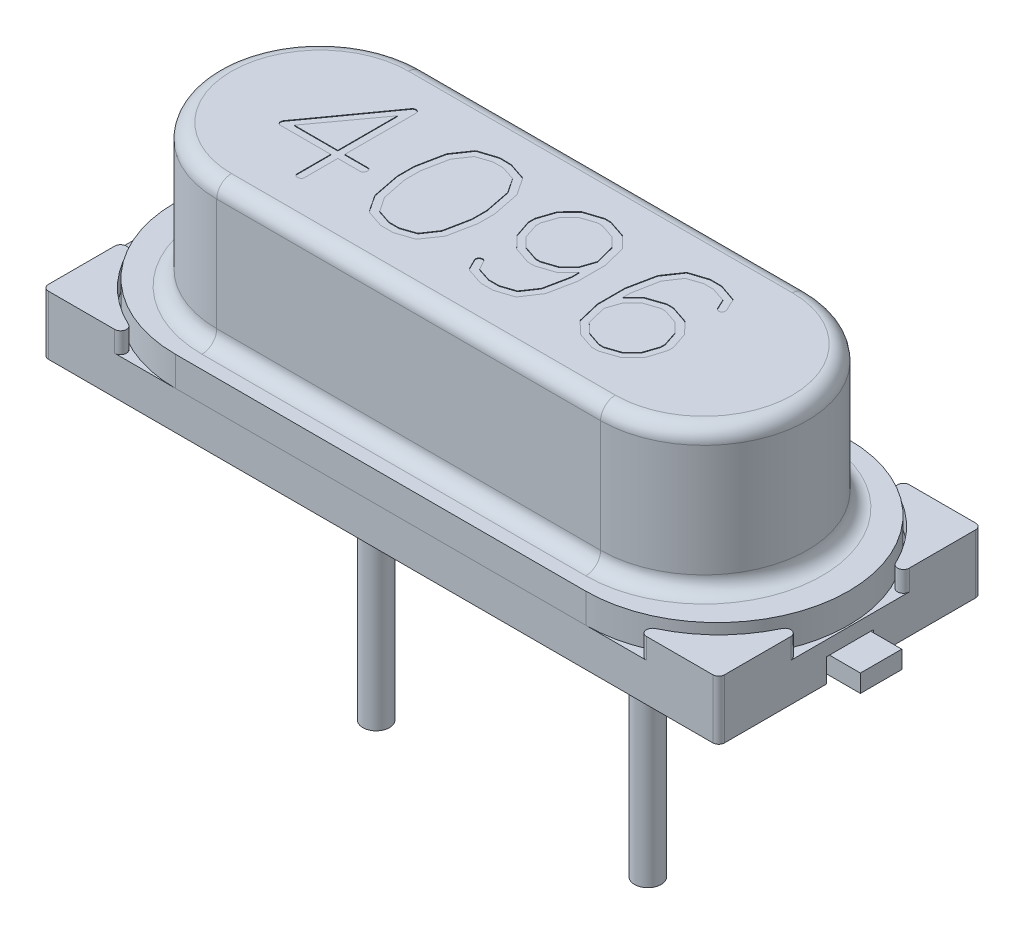
from build123d import *

# Parameters (mm, degrees)
SKETCH1_W             = 11.45
SKETCH1_H             = 4.45
BOSS_EXTRUDE1_DEPTH   = 1
CUT_EXTRUDE2_DEPTH    = 0.35
FILLET1_R             = 0.1
BOSS_EXTRUDE2_DEPTH   = 0.5
BOSS_EXTRUDE3_DEPTH   = 2.4
FILLET2_R             = 0.25
CUT_EXTRUDE3_DEPTH    = 0.01
SKETCH6_W             = 5.638304111
SKETCH6_H             = 0.8
CUT_EXTRUDE4_DEPTH    = 0.4
BOSS_EXTRUDE4_DEPTH   = 0.3
BOSS_EXTRUDE4_2_DEPTH = 0.3
SKETCH8_R             = 0.825
CUT_EXTRUDE5_DEPTH    = 0.01
SKETCH9_R             = 0.225
BOSS_EXTRUDE5_DEPTH   = 5.4


with BuildPart() as part:
    # Sketch1 → Boss-Extrude1 (new body)
    with BuildSketch(Plane(origin=(0, 0, 0), x_dir=(1, 0, 0), z_dir=(0, 1, 0))):
        Rectangle(SKETCH1_W, SKETCH1_H)
    extrude(amount=-BOSS_EXTRUDE1_DEPTH)

    # Sketch2 → Cut-Extrude2 (cut)
    with BuildSketch(Plane(origin=(0, 0, 0), x_dir=(1, 0, 0), z_dir=(0, 1, 0))):
        with BuildLine():
            Line((-3.5, 2.25), (3.5, 2.25))
            ThreePointArc((3.5, 2.25), (5.75, 0), (3.5, -2.25))
            Line((3.5, -2.25), (-3.5, -2.25))
            ThreePointArc((-3.5, -2.25), (-5.75, 0), (-3.5, 2.25))
        make_face()
    extrude(amount=-CUT_EXTRUDE2_DEPTH, mode=Mode.SUBTRACT)

    # Fillet1
    fillet1_edges = [part.edges().sort_by_distance(p)[0] for p in [
        (-3.834477204, -0.175, 2.225),
        (-5.725, -0.175, 0.334477204),
        (-5.725, -0.175, -0.334477204),
        (-3.834477204, -0.175, -2.225),
        (5.725, -0.175, -0.334477204),
        (5.725, -0.175, 0.334477204),
        (3.834477204, -0.175, 2.225),
        (3.834477204, -0.175, -2.225),
        (5.725, -0.5, 2.225),
        (-5.725, -0.5, 2.225),
        (-5.725, -0.5, -2.225),
        (5.725, -0.5, -2.225),
    ]]
    fillet(fillet1_edges, radius=FILLET1_R)

    # Sketch6 → Cut-Extrude4 (cut)
    with BuildSketch(Plane.XZ.offset(1)):
        with Locations((-5.019152056, 0)):
            Rectangle(SKETCH6_W, SKETCH6_H)
        with Locations((5.019152056, 0)):
            Rectangle(SKETCH6_W, SKETCH6_H)
    extrude(amount=-CUT_EXTRUDE4_DEPTH, mode=Mode.SUBTRACT)


with BuildPart() as body_2:
    # Sketch3 → Boss-Extrude2 (new body)
    with BuildSketch(Plane(origin=(0, -0.35, 0), x_dir=(1, 0, 0), z_dir=(0, 1, 0))):
        with BuildLine():
            Line((-3.475, 2.225), (3.475, 2.225))
            ThreePointArc((3.475, 2.225), (5.7, 0), (3.475, -2.225))
            Line((3.475, -2.225), (-3.475, -2.225))
            ThreePointArc((-3.475, -2.225), (-5.7, 0), (-3.475, 2.225))
        make_face()
    extrude(amount=BOSS_EXTRUDE2_DEPTH)

    # Sketch4 → Boss-Extrude3 (add)
    with BuildSketch(Plane(origin=(0, 0.15, 0), x_dir=(1, 0, 0), z_dir=(0, 1, 0))):
        with BuildLine():
            Line((-3.25, 1.75), (3.25, 1.75))
            ThreePointArc((3.25, 1.75), (5, 0), (3.25, -1.75))
            Line((3.25, -1.75), (-3.25, -1.75))
            ThreePointArc((-3.25, -1.75), (-5, 0), (-3.25, 1.75))
        make_face()
    extrude(amount=BOSS_EXTRUDE3_DEPTH)

    # Fillet2
    fillet2_edges = [body_2.edges().sort_by_distance(p)[0] for p in [
        (-5, 0.15, 0),
        (0, 0.15, 1.75),
        (5, 0.15, 0),
        (0, 0.15, -1.75),
        (-5, 2.55, 0),
        (0, 2.55, 1.75),
        (5, 2.55, 0),
        (0, 2.55, -1.75),
    ]]
    fillet(fillet2_edges, radius=FILLET2_R)

    # Sketch5 → Cut-Extrude3 (cut)
    # profile 1 of 4: a face of its own
    with BuildSketch(Plane(origin=(0, 2.55, 0), x_dir=(1, 0, 0), z_dir=(0, 1, 0))):
        with BuildLine():
            Line((-2.579613095, 0.972619048), (-2.571428571, 0.95327381))
            Line((-2.571428571, 0.95327381), (-2.571428571, -0.25952381))
            Line((-2.571428571, -0.25952381), (-2.175223214, -0.25952381))
            add(Edge.make_bspline(
                [(-2.175223214, -0.25952381), (-2.169995179, -0.260915744), (-2.159866911, -0.263612336), (-2.147043033, -0.273515312), (-2.139062354, -0.288483231), (-2.136940041, -0.299856703), (-2.13578869, -0.306026786)],
                knots=[0, 0, 0, 0, 0.979500305, 1.897585042, 2.859444737, 4, 4, 4, 4], degree=3))
            add(Edge.make_bspline(
                [(-2.13578869, -0.306026786), (-2.135994016, -0.313261221), (-2.136370658, -0.326531767), (-2.141042701, -0.344658389), (-2.148002784, -0.359864656), (-2.155866006, -0.366747839), (-2.159598214, -0.370014881)],
                knots=[0, 0, 0, 0, 1.223484903, 2.24430974, 3.166677144, 4, 4, 4, 4], degree=3))
            Line((-2.159598214, -0.370014881), (-2.180803571, -0.378571429))
            Line((-2.180803571, -0.378571429), (-2.571428571, -0.378571429))
            Line((-2.571428571, -0.378571429), (-2.571428571, -0.95483631))
            add(Edge.make_bspline(
                [(-2.571428571, -0.95483631), (-2.572821885, -0.959041639), (-2.575457447, -0.96699635), (-2.582647799, -0.976721347), (-2.590272887, -0.985049969), (-2.602371768, -0.991127936), (-2.615813455, -0.996051261), (-2.626454806, -0.997153279), (-2.630952381, -0.997619048)],
                knots=[0, 0, 0, 0, 1.006492665, 1.903860076, 2.74662138, 3.559717469, 4.968612883, 6, 6, 6, 6], degree=3))
            add(Edge.make_bspline(
                [(-2.630952381, -0.997619048), (-2.639748579, -0.997268595), (-2.655523951, -0.996640081), (-2.675984291, -0.987122041), (-2.689025253, -0.970173205), (-2.689969578, -0.956559469), (-2.69047619, -0.949255952)],
                knots=[0, 0, 0, 0, 1.203198397, 2.157853217, 3.011722445, 4, 4, 4, 4], degree=3))
            Line((-2.69047619, -0.949255952), (-2.69047619, -0.378571429))
            Line((-2.69047619, -0.378571429), (-3.548735119, -0.378571429))
            add(Edge.make_bspline(
                [(-3.548735119, -0.378571429), (-3.55430374, -0.377268995), (-3.564889923, -0.374793013), (-3.578838909, -0.366107964), (-3.589139275, -0.353290948), (-3.593152992, -0.342996644), (-3.595238095, -0.33764881)],
                knots=[0, 0, 0, 0, 1.042993972, 1.982775231, 2.9520629, 4, 4, 4, 4], degree=3))
            Line((-3.595238095, -0.33764881), (-3.595238095, -0.321279762))
            add(Edge.make_bspline(
                [(-3.595238095, -0.321279762), (-3.59466811, -0.314029544), (-3.59350606, -0.29924824), (-3.585534653, -0.286733442), (-3.581473214, -0.280357143)],
                knots=[0, 0, 0, 0, 0.980998486, 2, 2, 2, 2], degree=3))
            Line((-3.581473214, -0.280357143), (-3.474330357, -0.133035714))
            Line((-3.474330357, -0.133035714), (-2.670386905, 0.986011905))
            add(Edge.make_bspline(
                [(-2.670386905, 0.986011905), (-2.663572924, 0.990774378), (-2.651057582, 0.999521684), (-2.635966844, 1.001486075), (-2.629092262, 1.002380952)],
                knots=[0, 0, 0, 0, 1.088900487, 2, 2, 2, 2], degree=3))
            add(Edge.make_bspline(
                [(-2.629092262, 1.002380952), (-2.627723952, 1.002151946), (-2.623951151, 1.001520512), (-2.620274659, 1.000455526), (-2.617931548, 0.999776786)],
                knots=[0, 0, 0, 0, 0.725354991, 2, 2, 2, 2], degree=3))
            add(Edge.make_bspline(
                [(-2.617931548, 0.999776786), (-2.613257185, 0.998777727), (-2.604543442, 0.996915324), (-2.59339972, 0.99067786), (-2.584652077, 0.982739104), (-2.58128538, 0.975977587), (-2.579613095, 0.972619048)],
                knots=[0, 0, 0, 0, 1.162506102, 2.167093341, 3.089569625, 4, 4, 4, 4], degree=3))
        make_face()
        Polygon((-3.427083333, -0.25952381), (-2.69047619, -0.25952381), (-2.69047619, 0.753497024), align=None, mode=Mode.SUBTRACT)
    # profile 2 of 4: a face of its own
    with BuildSketch(Plane(origin=(0, 2.55, 0), x_dir=(1, 0, 0), z_dir=(0, 1, 0))):
        with BuildLine():
            add(Edge.make_bspline(
                [(-1.012276786, 0.999776786), (-1.003964468, 0.996935625), (-0.986337607, 0.990910741), (-0.958512879, 0.981137184), (-0.927443458, 0.970794037), (-0.89340553, 0.959193318), (-0.856114547, 0.947058565), (-0.816022517, 0.933528467), (-0.772682568, 0.919452629), (-0.742804424, 0.909632446), (-0.727306548, 0.90453869)],
                knots=[0, 0, 0, 0, 0.701660968, 1.487921959, 2.355571994, 3.317190182, 4.360247517, 5.487871983, 6.696952224, 8, 8, 8, 8], degree=3))
            Line((-0.727306548, 0.90453869), (-0.70796131, 0.885565476))
            Line((-0.70796131, 0.885565476), (-0.524553571, 0.608779762))
            Line((-0.524553571, 0.608779762), (-0.518973214, 0.592782738))
            Line((-0.518973214, 0.592782738), (-0.428571429, 0.136681548))
            Line((-0.428571429, 0.136681548), (-0.428571429, -0.145684524))
            Line((-0.428571429, -0.145684524), (-0.518973214, -0.60141369))
            Line((-0.518973214, -0.60141369), (-0.530133929, -0.620386905))
            Line((-0.530133929, -0.620386905), (-0.716145833, -0.891964286))
            Line((-0.716145833, -0.891964286), (-0.729910714, -0.902752976))
            add(Edge.make_bspline(
                [(-0.729910714, -0.902752976), (-0.739105416, -0.90529657), (-0.759452591, -0.91092535), (-0.792553647, -0.921670526), (-0.831508112, -0.934021625), (-0.873869304, -0.948928774), (-0.916129037, -0.963513835), (-0.954424903, -0.976363851), (-0.986619972, -0.987662057), (-1.00607699, -0.99451721), (-1.014880952, -0.997619048)],
                knots=[0, 0, 0, 0, 0.762114036, 1.68650047, 2.779979974, 4.027002159, 5.274024345, 6.35181635, 7.254225619, 8, 8, 8, 8], degree=3))
            Line((-1.014880952, -0.997619048), (-1.225818452, -0.997619048))
            add(Edge.make_bspline(
                [(-1.225818452, -0.997619048), (-1.234239994, -0.994856453), (-1.252165173, -0.988976294), (-1.280760187, -0.980413698), (-1.311828887, -0.969685735), (-1.346068497, -0.958691031), (-1.382985462, -0.945808849), (-1.423245207, -0.932773285), (-1.46595139, -0.917552791), (-1.495521258, -0.907547076), (-1.51078869, -0.902380952)],
                knots=[0, 0, 0, 0, 0.707906692, 1.506773219, 2.383791417, 3.332855564, 4.379031741, 5.506626567, 6.71262828, 8, 8, 8, 8], degree=3))
            Line((-1.51078869, -0.902380952), (-1.530133929, -0.886383929))
            Line((-1.530133929, -0.886383929), (-1.713541667, -0.608854167))
            Line((-1.713541667, -0.608854167), (-1.719122024, -0.592857143))
            Line((-1.719122024, -0.592857143), (-1.80952381, -0.136383929))
            Line((-1.80952381, -0.136383929), (-1.80952381, 0.151934524))
            Line((-1.80952381, 0.151934524), (-1.719122024, 0.605803571))
            Line((-1.719122024, 0.605803571), (-1.7109375, 0.621800595))
            Line((-1.7109375, 0.621800595), (-1.524553571, 0.89375))
            Line((-1.524553571, 0.89375), (-1.508184524, 0.907142857))
            add(Edge.make_bspline(
                [(-1.508184524, 0.907142857), (-1.498875926, 0.909844311), (-1.478228109, 0.915836527), (-1.444290808, 0.926394155), (-1.404215322, 0.938977638), (-1.360062712, 0.953225751), (-1.315950763, 0.967842214), (-1.275947101, 0.981264378), (-1.241917137, 0.992392912), (-1.221351051, 0.999271357), (-1.212053571, 1.002380952)],
                knots=[0, 0, 0, 0, 0.747758559, 1.658636604, 2.741865765, 3.988370732, 5.237845973, 6.326973741, 7.243661272, 8, 8, 8, 8], degree=3))
            Line((-1.212053571, 1.002380952), (-1.012276786, 0.999776786))
        make_face()
        Polygon((-0.797991071, 0.807440476), (-1.031994048, 0.883333333), (-1.20610119, 0.883333333), (-1.442708333, 0.80483631), (-1.606026786, 0.564136905), (-1.69047619, 0.141889881), (-1.69047619, -0.126339286), (-1.603422619, -0.55639881), (-1.440104167, -0.800074405), (-1.20610119, -0.878571429), (-1.034598214, -0.878571429), (-0.795386905, -0.797470238), (-0.632068452, -0.55639881), (-0.547619048, -0.131547619), (-0.547619048, 0.125520833), (-0.634672619, 0.564136905), align=None, mode=Mode.SUBTRACT)
    # profile 3 of 4: a face of its own
    with BuildSketch(Plane(origin=(0, 2.55, 0), x_dir=(1, 0, 0), z_dir=(0, 1, 0))):
        with BuildLine():
            add(Edge.make_bspline(
                [(0.962425595, 0.90453869), (0.973578842, 0.893742297), (0.995129407, 0.87288125), (1.026378173, 0.84287388), (1.055116382, 0.814815594), (1.081575356, 0.7889411), (1.105259046, 0.764634107), (1.126975653, 0.742697373), (1.146220935, 0.722751358), (1.158125856, 0.70998509), (1.163690476, 0.704017857)],
                knots=[0, 0, 0, 0, 1.311123651, 2.533384019, 3.659256471, 4.703587179, 5.659043355, 6.525625502, 7.31084517, 8, 8, 8, 8], degree=3))
            add(Edge.make_bspline(
                [(1.163690476, 0.704017857), (1.165371633, 0.695289732), (1.169295671, 0.674917155), (1.176144758, 0.655322077), (1.180059524, 0.644122024)],
                knots=[0, 0, 0, 0, 0.856850361, 2, 2, 2, 2], degree=3))
            Line((1.180059524, 0.644122024), (1.261904762, 0.315997024))
            Line((1.261904762, 0.315997024), (1.261904762, -0.14828869))
            Line((1.261904762, -0.14828869), (1.169270833, -0.604017857))
            Line((1.169270833, -0.604017857), (1.155505952, -0.622991071))
            Line((1.155505952, -0.622991071), (0.975818452, -0.894568452))
            Line((0.975818452, -0.894568452), (0.953869048, -0.90796131))
            add(Edge.make_bspline(
                [(0.953869048, -0.90796131), (0.945681027, -0.910554581), (0.928296062, -0.916060665), (0.90066801, -0.925069568), (0.870052189, -0.935033396), (0.836473055, -0.945907707), (0.799933077, -0.957308115), (0.760484375, -0.970178873), (0.717822109, -0.98329308), (0.688480952, -0.992747641), (0.673363095, -0.997619048)],
                knots=[0, 0, 0, 0, 0.699967742, 1.486185097, 2.368276625, 3.32389879, 4.362689166, 5.487718558, 6.70556191, 8, 8, 8, 8], degree=3))
            Line((0.673363095, -0.997619048), (0.466145833, -0.997619048))
            add(Edge.make_bspline(
                [(0.466145833, -0.997619048), (0.45795865, -0.995023221), (0.440575464, -0.989511711), (0.413044303, -0.980585582), (0.382719814, -0.970490126), (0.349250342, -0.959789889), (0.313169739, -0.947371827), (0.273929176, -0.934627981), (0.232235289, -0.919720468), (0.203266896, -0.910017187), (0.188244048, -0.904985119)],
                knots=[0, 0, 0, 0, 0.703658691, 1.494021792, 2.37110896, 3.322105247, 4.372680049, 5.497143234, 6.702032305, 8, 8, 8, 8], degree=3))
            add(Edge.make_bspline(
                [(0.188244048, -0.904985119), (0.186860413, -0.904144912), (0.18313973, -0.90188554), (0.176850475, -0.89642264), (0.16850803, -0.888137841), (0.161856314, -0.882018048), (0.158110119, -0.878571429)],
                knots=[0, 0, 0, 0, 0.483237896, 1.299458199, 2.479075808, 4, 4, 4, 4], degree=3))
            Line((0.158110119, -0.878571429), (0.06547619, -0.693303571))
            add(Edge.make_bspline(
                [(0.06547619, -0.693303571), (0.065703271, -0.687063484), (0.066142404, -0.674996282), (0.07109764, -0.658335059), (0.078654854, -0.6435747), (0.086204879, -0.636085657), (0.090029762, -0.632291667)],
                knots=[0, 0, 0, 0, 1.100929796, 2.128999637, 3.052141028, 4, 4, 4, 4], degree=3))
            add(Edge.make_bspline(
                [(0.090029762, -0.632291667), (0.099405554, -0.629982552), (0.115448298, -0.62603147), (0.131919764, -0.624934881), (0.138764881, -0.624479167)],
                knots=[0, 0, 0, 0, 1.168851538, 2, 2, 2, 2], degree=3))
            add(Edge.make_bspline(
                [(0.138764881, -0.624479167), (0.142936465, -0.62632332), (0.150863421, -0.62982763), (0.161015598, -0.637039299), (0.169398585, -0.645214619), (0.172553133, -0.652009711), (0.174107143, -0.655357143)],
                knots=[0, 0, 0, 0, 1.131634214, 2.150362058, 3.088822117, 4, 4, 4, 4], degree=3))
            Line((0.174107143, -0.655357143), (0.255208333, -0.804166667))
            Line((0.255208333, -0.804166667), (0.485863095, -0.878571429))
            Line((0.485863095, -0.878571429), (0.659598214, -0.878571429))
            Line((0.659598214, -0.878571429), (0.892857143, -0.801190476))
            Line((0.892857143, -0.801190476), (1.058407738, -0.558258929))
            Line((1.058407738, -0.558258929), (1.145089286, -0.134151786))
            add(Edge.make_bspline(
                [(1.145089286, -0.134151786), (1.145120383, -0.121254795), (1.145178392, -0.097196258), (1.14480865, -0.063836094), (1.144171776, -0.035800958), (1.143264344, -0.018946985), (1.142857143, -0.011383929)],
                knots=[0, 0, 0, 0, 1.260201485, 2.350827779, 3.259949999, 4, 4, 4, 4], degree=3))
            Line((1.142857143, -0.011383929), (0.9609375, -0.193303571))
            add(Edge.make_bspline(
                [(0.9609375, -0.193303571), (0.951891401, -0.196299634), (0.93171404, -0.202982363), (0.898348244, -0.213492256), (0.859245341, -0.226900423), (0.815952106, -0.240486916), (0.772820856, -0.254199003), (0.734208434, -0.267578719), (0.701482528, -0.277922826), (0.682024466, -0.28501341), (0.673363095, -0.288169643)],
                knots=[0, 0, 0, 0, 0.755214709, 1.684509572, 2.772258172, 4.031034614, 5.280453424, 6.358882943, 7.269489218, 8, 8, 8, 8], degree=3))
            add(Edge.make_bspline(
                [(0.673363095, -0.288169643), (0.668648491, -0.28838484), (0.656844638, -0.288923626), (0.64508408, -0.290079566), (0.638020833, -0.29077381)],
                knots=[0, 0, 0, 0, 0.798824536, 2, 2, 2, 2], degree=3))
            add(Edge.make_bspline(
                [(0.638020833, -0.29077381), (0.631572421, -0.29077381), (0.619915675, -0.29077381), (0.608258929, -0.29077381), (0.603050595, -0.29077381)],
                knots=[0, 0, 0, 0, 1.106382979, 2, 2, 2, 2], degree=3))
            add(Edge.make_bspline(
                [(0.603050595, -0.29077381), (0.595104797, -0.290377711), (0.57604698, -0.289427679), (0.55714949, -0.286752984), (0.546130952, -0.285193452)],
                knots=[0, 0, 0, 0, 0.833862317, 2, 2, 2, 2], degree=3))
            add(Edge.make_bspline(
                [(0.546130952, -0.285193452), (0.525202067, -0.277670808), (0.4820932, -0.262175826), (0.415139374, -0.239921366), (0.344904579, -0.215757287), (0.296653463, -0.200168694), (0.271949405, -0.1921875)],
                knots=[0, 0, 0, 0, 0.921700048, 1.898497955, 2.924053307, 4, 4, 4, 4], degree=3))
            add(Edge.make_bspline(
                [(0.271949405, -0.1921875), (0.265980826, -0.186375488), (0.253352939, -0.174078854), (0.233657073, -0.154214793), (0.211700422, -0.132396254), (0.187907786, -0.108196135), (0.162359773, -0.081788006), (0.134583348, -0.053385188), (0.104960495, -0.022615726), (0.08456423, -0.001224042), (0.074032738, 0.009821429)],
                knots=[0, 0, 0, 0, 0.706943354, 1.495699609, 2.373749025, 3.333679347, 4.375539188, 5.49180291, 6.704907092, 8, 8, 8, 8], degree=3))
            Line((0.074032738, 0.009821429), (-0.023809524, 0.299627976))
            Line((-0.023809524, 0.299627976), (-0.023809524, 0.411979167))
            Line((-0.023809524, 0.411979167), (0.071428571, 0.698809524))
            add(Edge.make_bspline(
                [(0.071428571, 0.698809524), (0.077254657, 0.704888109), (0.08951346, 0.717678203), (0.109102737, 0.738019441), (0.130814287, 0.760455115), (0.154624264, 0.785008271), (0.180536373, 0.811675415), (0.208570934, 0.840436745), (0.2388245, 0.871443013), (0.259670493, 0.892760013), (0.27046131, 0.903794643)],
                knots=[0, 0, 0, 0, 0.707255945, 1.488153929, 2.372154819, 3.32980278, 4.361099159, 5.49550509, 6.7035617, 8, 8, 8, 8], degree=3))
            Line((0.27046131, 0.903794643), (0.572916667, 1.002380952))
            Line((0.572916667, 1.002380952), (0.676339286, 0.999776786))
            Line((0.676339286, 0.999776786), (0.962425595, 0.90453869))
        make_face()
        Polygon((0.901041667, 0.791443452), (0.659598214, 0.872916667), (0.575520833, 0.875520833), (0.331473214, 0.794047619), (0.174107143, 0.634077381), (0.092633929, 0.395238095), (0.090029762, 0.314136905), (0.171502976, 0.067113095), (0.331473214, -0.092857143), (0.575520833, -0.174330357), (0.65141369, -0.174330357), (0.8984375, -0.092857143), (1.058407738, 0.067113095), (1.139880952, 0.308556548), (1.055803571, 0.634077381), align=None, mode=Mode.SUBTRACT)
    # profile 4 of 4: a face of its own
    with BuildSketch(Plane(origin=(0, 2.55, 0), x_dir=(1, 0, 0), z_dir=(0, 1, 0))):
        with BuildLine():
            add(Edge.make_bspline(
                [(2.553943452, 0.999776786), (2.562133496, 0.997064958), (2.579407348, 0.991345367), (2.606764634, 0.981901241), (2.636991562, 0.97151811), (2.670262207, 0.960575002), (2.706006841, 0.947546506), (2.744896447, 0.934367576), (2.786791043, 0.920285656), (2.815489476, 0.910157673), (2.830357143, 0.904910714)],
                knots=[0, 0, 0, 0, 0.708495826, 1.494308503, 2.376731357, 3.333206145, 4.370366408, 5.500780582, 6.705240708, 8, 8, 8, 8], degree=3))
            add(Edge.make_bspline(
                [(2.830357143, 0.904910714), (2.83651013, 0.901512853), (2.849462084, 0.894360403), (2.856450543, 0.8812742), (2.860119048, 0.874404762)],
                knots=[0, 0, 0, 0, 0.950124999, 2, 2, 2, 2], degree=3))
            add(Edge.make_bspline(
                [(2.860119048, 0.874404762), (2.862488033, 0.868705193), (2.866651325, 0.858688683), (2.871778134, 0.845935014), (2.874954354, 0.837641247), (2.876126553, 0.833609567), (2.876488095, 0.832366071)],
                knots=[0, 0, 0, 0, 1.64099522, 2.883909998, 3.655762989, 4, 4, 4, 4], degree=3))
            Line((2.876488095, 0.832366071), (2.949776786, 0.685044643))
            add(Edge.make_bspline(
                [(2.949776786, 0.685044643), (2.949765458, 0.678335971), (2.949745282, 0.666386733), (2.948313817, 0.650884512), (2.94629959, 0.639364629), (2.942957175, 0.634025523), (2.941592262, 0.631845238)],
                knots=[0, 0, 0, 0, 1.473414105, 2.62439101, 3.438254585, 4, 4, 4, 4], degree=3))
            add(Edge.make_bspline(
                [(2.941592262, 0.631845238), (2.938811118, 0.62805502), (2.933324442, 0.620577628), (2.921656955, 0.612744649), (2.908164499, 0.607514406), (2.898368049, 0.607124286), (2.893229167, 0.606919643)],
                knots=[0, 0, 0, 0, 0.985461084, 1.944130654, 2.921561274, 4, 4, 4, 4], degree=3))
            add(Edge.make_bspline(
                [(2.893229167, 0.606919643), (2.888727502, 0.607346876), (2.883204484, 0.607871042), (2.877850258, 0.609265869), (2.876860119, 0.60952381)],
                knots=[0, 0, 0, 0, 1.630146534, 2, 2, 2, 2], degree=3))
            add(Edge.make_bspline(
                [(2.876860119, 0.60952381), (2.875092267, 0.610467697), (2.870670372, 0.612828626), (2.863755602, 0.618729545), (2.854687521, 0.627017476), (2.848177471, 0.633664609), (2.844494048, 0.637425595)],
                knots=[0, 0, 0, 0, 0.559315808, 1.399006286, 2.528342755, 4, 4, 4, 4], degree=3))
            Line((2.844494048, 0.637425595), (2.766369048, 0.803348214))
            Line((2.766369048, 0.803348214), (2.53125, 0.883333333))
            Line((2.53125, 0.883333333), (2.361235119, 0.883333333))
            Line((2.361235119, 0.883333333), (2.129092262, 0.804092262))
            Line((2.129092262, 0.804092262), (1.964657738, 0.5578125))
            Line((1.964657738, 0.5578125), (1.880952381, 0.119940476))
            Line((1.880952381, 0.119940476), (1.880952381, -0.003199405))
            Line((1.880952381, -0.003199405), (2.061755952, 0.175744048))
            add(Edge.make_bspline(
                [(2.061755952, 0.175744048), (2.070184643, 0.178484162), (2.087900123, 0.184243353), (2.11613889, 0.193145735), (2.147379386, 0.203600142), (2.181636818, 0.215528199), (2.219016761, 0.228144322), (2.259357634, 0.241923798), (2.302709448, 0.257200199), (2.332712933, 0.267759042), (2.348214286, 0.273214286)],
                knots=[0, 0, 0, 0, 0.70293754, 1.477438854, 2.348300821, 3.315624652, 4.354457194, 5.477285858, 6.69663542, 8, 8, 8, 8], degree=3))
            Line((2.348214286, 0.273214286), (2.410342262, 0.273214286))
            add(Edge.make_bspline(
                [(2.410342262, 0.273214286), (2.417782101, 0.273100743), (2.431302024, 0.27289441), (2.449582325, 0.272475435), (2.463773486, 0.270699411), (2.471736601, 0.268801484), (2.475074405, 0.268005952)],
                knots=[0, 0, 0, 0, 1.371342405, 2.492048891, 3.367930168, 4, 4, 4, 4], degree=3))
            Line((2.475074405, 0.268005952), (2.7421875, 0.179092262))
            Line((2.7421875, 0.179092262), (2.758556548, 0.168303571))
            Line((2.758556548, 0.168303571), (2.941964286, -0.017708333))
            Line((2.941964286, -0.017708333), (2.95014881, -0.033705357))
            add(Edge.make_bspline(
                [(2.95014881, -0.033705357), (2.958204253, -0.05826053), (2.973875016, -0.106029261), (2.996903405, -0.17594237), (3.019588514, -0.242002747), (3.034694209, -0.28483127), (3.04203869, -0.305654762)],
                knots=[0, 0, 0, 0, 1.080294536, 2.101565233, 3.076969305, 4, 4, 4, 4], degree=3))
            Line((3.04203869, -0.305654762), (3.04203869, -0.375595238))
            add(Edge.make_bspline(
                [(3.04203869, -0.375595238), (3.041649119, -0.381312681), (3.040710161, -0.395093023), (3.035790524, -0.418953419), (3.027648756, -0.4494406), (3.017408368, -0.487150974), (3.003419464, -0.531575847), (2.986726854, -0.583101106), (2.966478098, -0.641250184), (2.952134299, -0.682391612), (2.944568452, -0.704092262)],
                knots=[0, 0, 0, 0, 0.400280443, 0.964767126, 1.698569089, 2.607165052, 3.695776378, 4.954101113, 6.39339596, 8, 8, 8, 8], degree=3))
            add(Edge.make_bspline(
                [(2.944568452, -0.704092262), (2.930652649, -0.719066855), (2.901454274, -0.750486801), (2.853644706, -0.797829638), (2.800844115, -0.848604742), (2.763234145, -0.88275925), (2.743675595, -0.900520833)],
                knots=[0, 0, 0, 0, 0.872684822, 1.831082082, 2.872083978, 4, 4, 4, 4], degree=3))
            add(Edge.make_bspline(
                [(2.743675595, -0.900520833), (2.694914201, -0.917923638), (2.599611715, -0.951936829), (2.503189233, -0.982629999), (2.45610119, -0.997619048)],
                knots=[0, 0, 0, 0, 1.02329743, 2, 2, 2, 2], degree=3))
            Line((2.45610119, -0.997619048), (2.344866071, -0.997619048))
            add(Edge.make_bspline(
                [(2.344866071, -0.997619048), (2.335823456, -0.994489158), (2.315922592, -0.98760094), (2.282923985, -0.976971936), (2.24459889, -0.963847282), (2.202384451, -0.94998968), (2.160261506, -0.936228063), (2.122097336, -0.922994654), (2.08928337, -0.912308378), (2.069318918, -0.905733676), (2.060267857, -0.902752976)],
                knots=[0, 0, 0, 0, 0.765508866, 1.684721447, 2.7733434, 4.006277222, 5.239211044, 6.318435038, 7.237647619, 8, 8, 8, 8], degree=3))
            add(Edge.make_bspline(
                [(2.060267857, -0.902752976), (2.05433155, -0.896908058), (2.041770761, -0.884540641), (2.021557534, -0.86532646), (1.999642229, -0.843586429), (1.975554227, -0.819932197), (1.949410784, -0.794115978), (1.921136182, -0.766339812), (1.891012953, -0.736070272), (1.870169125, -0.715247505), (1.859375, -0.704464286)],
                knots=[0, 0, 0, 0, 0.708307873, 1.498727217, 2.371047817, 3.332830965, 4.369166627, 5.494965671, 6.702750079, 8, 8, 8, 8], degree=3))
            Line((1.859375, -0.704464286), (1.8515625, -0.688095238))
            Line((1.8515625, -0.688095238), (1.761904762, -0.313839286))
            Line((1.761904762, -0.313839286), (1.761904762, 0.153050595))
            Line((1.761904762, 0.153050595), (1.854166667, 0.606175595))
            Line((1.854166667, 0.606175595), (1.86235119, 0.622544643))
            Line((1.86235119, 0.622544643), (2.046502976, 0.89375))
            Line((2.046502976, 0.89375), (2.062872024, 0.907514881))
            add(Edge.make_bspline(
                [(2.062872024, 0.907514881), (2.072063675, 0.910068127), (2.092518142, 0.915749944), (2.125905181, 0.926375205), (2.16545259, 0.93905472), (2.209135682, 0.953221114), (2.252881236, 0.967820015), (2.292603465, 0.981341427), (2.326437787, 0.992313793), (2.346856785, 0.999261014), (2.356026786, 1.002380952)],
                knots=[0, 0, 0, 0, 0.74292943, 1.653264037, 2.728410129, 3.977609534, 5.229829531, 6.320181464, 7.245607624, 8, 8, 8, 8], degree=3))
            Line((2.356026786, 1.002380952), (2.553943452, 0.999776786))
        make_face()
        Polygon((2.684895833, 0.075297619), (2.443824405, 0.156770833), (2.365327381, 0.156770833), (2.119047619, 0.075297619), (1.962053571, -0.084672619), (1.880952381, -0.326116071), (1.962053571, -0.654241071), (2.119047619, -0.809002976), (2.360119048, -0.89047619), (2.441220238, -0.893080357), (2.684895833, -0.811607143), (2.844494048, -0.651636905), (2.925595238, -0.407589286), (2.925595238, -0.331696429), (2.844494048, -0.084672619), align=None, mode=Mode.SUBTRACT)
    extrude(amount=-CUT_EXTRUDE3_DEPTH, mode=Mode.SUBTRACT)

    # Sketch8 → Cut-Extrude5 (cut)
    with BuildSketch(Plane.XZ.offset(0.35)):
        with Locations(Location((2.3, 0, 0), (0, 0, 270))):
            Circle(SKETCH8_R)
        with Locations(Location((-2.3, 0, 0), (0, 0, 270))):
            Circle(SKETCH8_R)
    extrude(amount=-CUT_EXTRUDE5_DEPTH, mode=Mode.SUBTRACT)

    # Sketch9 → Boss-Extrude5 (add)
    with BuildSketch(Plane.XZ.offset(0.34)):
        with Locations(Location((2.3, 0, 0), (0, 0, 270))):
            Circle(SKETCH9_R)
        with Locations(Location((-2.3, 0, 0), (0, 0, 90))):
            Circle(SKETCH9_R)
    extrude(amount=BOSS_EXTRUDE5_DEPTH)


with BuildPart() as body_3:
    # Sketch7 → Boss-Extrude4 (new body)
    with BuildSketch(Plane.XZ.offset(0.6)):
        Polygon((5.675, 0.35), (6.25, 0.35), (6.25, -0.35), (5.675, -0.35), (2.25, -0.35), (2.25, 0.35), align=None)
    extrude(amount=BOSS_EXTRUDE4_DEPTH)


with BuildPart() as body_4:
    # Sketch7 → Boss-Extrude4 2 (new body)
    with BuildSketch(Plane.XZ.offset(0.6)):
        Polygon((-5.675, 0.35), (-6.25, 0.35), (-6.25, -0.35), (-5.675, -0.35), (-2.25, -0.35), (-2.25, 0.35), align=None)
    extrude(amount=BOSS_EXTRUDE4_2_DEPTH)


solid = Compound([part.part, body_2.part, body_3.part, body_4.part])
